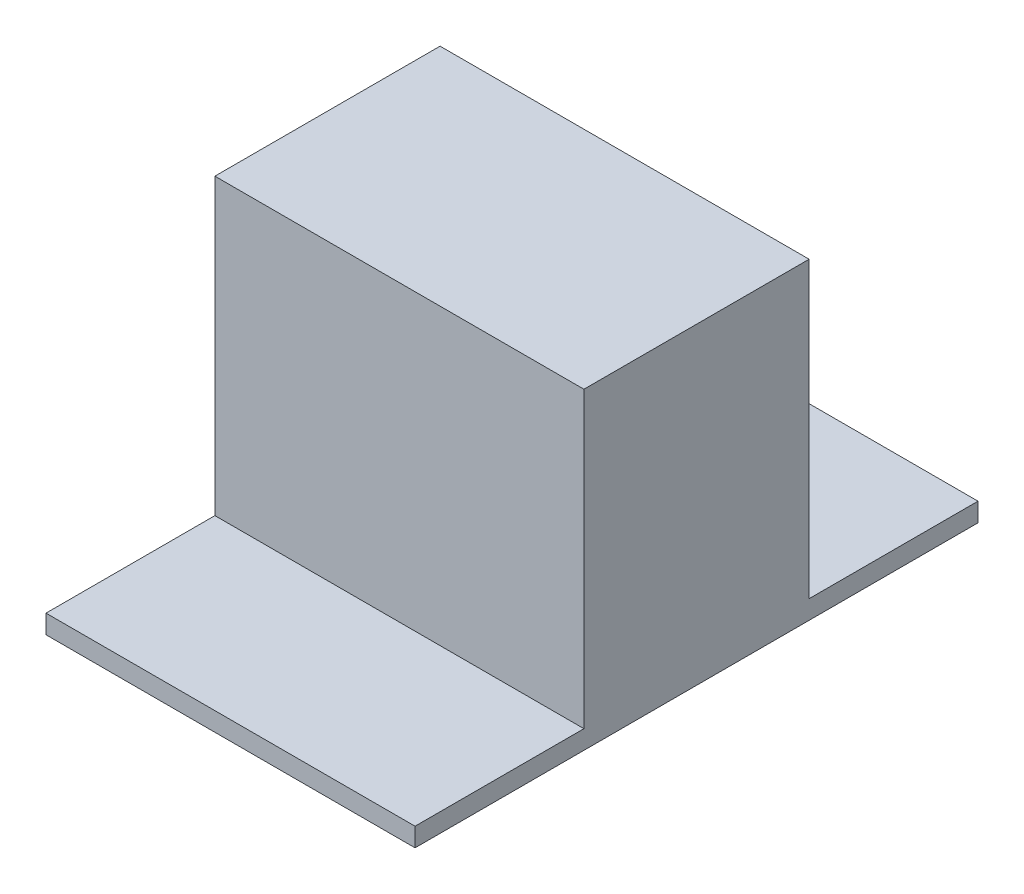
from build123d import *

# Parameters (mm, degrees)
ESQUISSE1_W             = 590
ESQUISSE1_H             = 500
BOSS_EXTRU_1_DEPTH      = 360
ESQUISSE2_W             = 530
ESQUISSE2_H             = 360
BOSS_EXTRU_2_DEPTH      = 10
ESQUISSE3_R             = 4
ENL_V_MAT_EXTRU_1_DEPTH = 10
ESQUISSE4_W             = 590
ESQUISSE4_H             = 30
BOSS_EXTRU_3_DEPTH      = 270
BOSS_EXTRU_4_START      = -360
ESQUISSE4_2_W           = 590
ESQUISSE4_2_H           = 30
BOSS_EXTRU_4_DEPTH      = 270


with BuildPart() as part:
    # Esquisse1 → Boss.-Extru.1 (new body)
    with BuildSketch(Plane.XY):
        with Locations((295, 250)):
            Rectangle(ESQUISSE1_W, ESQUISSE1_H)
    extrude(amount=BOSS_EXTRU_1_DEPTH)

    # Esquisse2 → Boss.-Extru.2 (add)
    with BuildSketch(Plane.XZ):
        with Locations((295, 180)):
            Rectangle(ESQUISSE2_W, ESQUISSE2_H)
    extrude(amount=BOSS_EXTRU_2_DEPTH)

    # Esquisse3 → Enlèv. mat.-Extru.1 (cut)
    with BuildSketch(Plane.XZ.offset(10)):
        with Locations(Location((75, 12.5, 0), (0, 0, 270))):
            Circle(ESQUISSE3_R)
        with Locations(Location((515, 12.5, 0), (0, 0, 270))):
            Circle(ESQUISSE3_R)
        with Locations(Location((515, 347.5, 0), (0, 0, 270))):
            Circle(ESQUISSE3_R)
        with Locations(Location((75, 347.5, 0), (0, 0, 270))):
            Circle(ESQUISSE3_R)
    extrude(amount=-ENL_V_MAT_EXTRU_1_DEPTH, mode=Mode.SUBTRACT)

    # Esquisse4 → Boss.-Extru.3 (add)
    with BuildSketch(Plane.XY.offset(360)):
        with Locations((295, 15)):
            Rectangle(ESQUISSE4_W, ESQUISSE4_H)
    extrude(amount=BOSS_EXTRU_3_DEPTH)

    # Esquisse4<2> → Boss.-Extru.4 (add)
    with BuildSketch(Plane.XY.offset(360).offset(BOSS_EXTRU_4_START)):
        with Locations((295, 15)):
            Rectangle(ESQUISSE4_2_W, ESQUISSE4_2_H)
    extrude(amount=-BOSS_EXTRU_4_DEPTH)


solid = part.part
